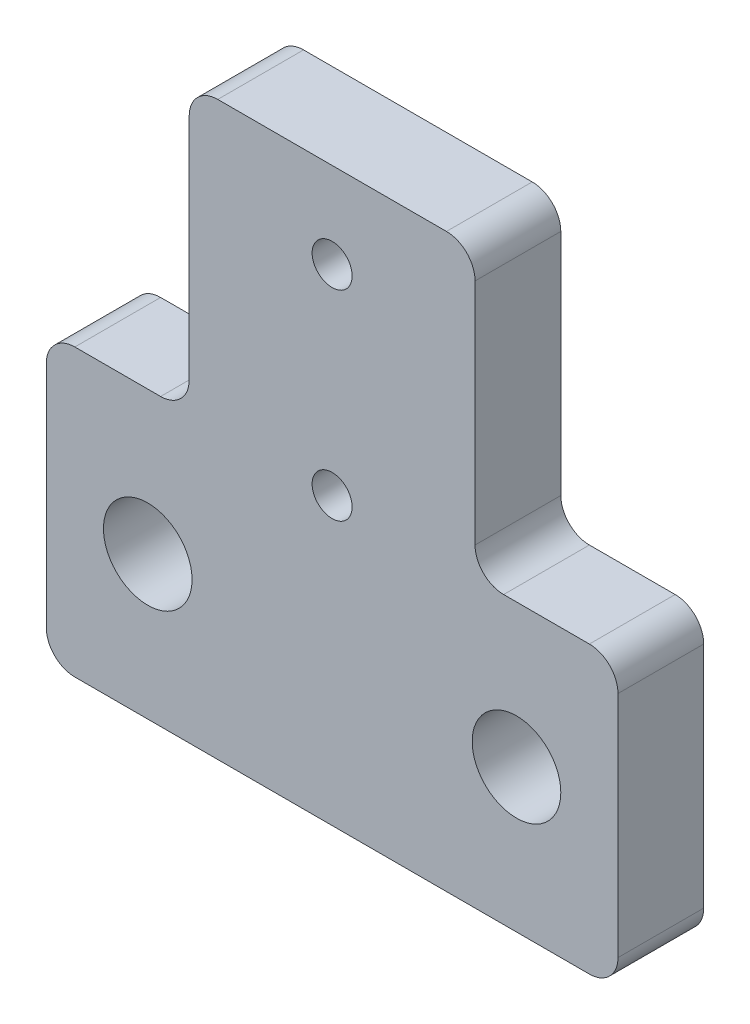
from build123d import *

# Parameters (mm, degrees)
SKETCH_1_R      = 1.55
SKETCH_1_R_2    = 0.7
EXTRUDE_1_DEPTH = 3
FILLET_1_R      = 1


with BuildPart() as part:
    # 草图1 → 凸台-拉伸1 (new body)
    with BuildSketch(Plane.XY):
        Polygon((-5, 10), (5, 10), (5, 0), (10, 0), (10, -10), (5, -10), (-5, -10), (-10, -10), (-10, 0), (-5, 0), align=None)
        with Locations((-6.45, -5)):
            Circle(SKETCH_1_R, mode=Mode.SUBTRACT)
        with Locations((6.45, -5)):
            Circle(SKETCH_1_R, mode=Mode.SUBTRACT)
        Circle(SKETCH_1_R_2, mode=Mode.SUBTRACT)
        with Locations((0, 7)):
            Circle(SKETCH_1_R_2, mode=Mode.SUBTRACT)
    extrude(amount=EXTRUDE_1_DEPTH)

    # 圆角1
    fillet_1_edges = [part.edges().sort_by_distance(p)[0] for p in [
        (-10, -10, 1.5),
        (-10, 0, 1.5),
        (-5, 0, 1.5),
        (-5, 10, 1.5),
        (5, 10, 1.5),
        (5, 0, 1.5),
        (10, 0, 1.5),
        (10, -10, 1.5),
    ]]
    fillet(fillet_1_edges, radius=FILLET_1_R)


solid = part.part
